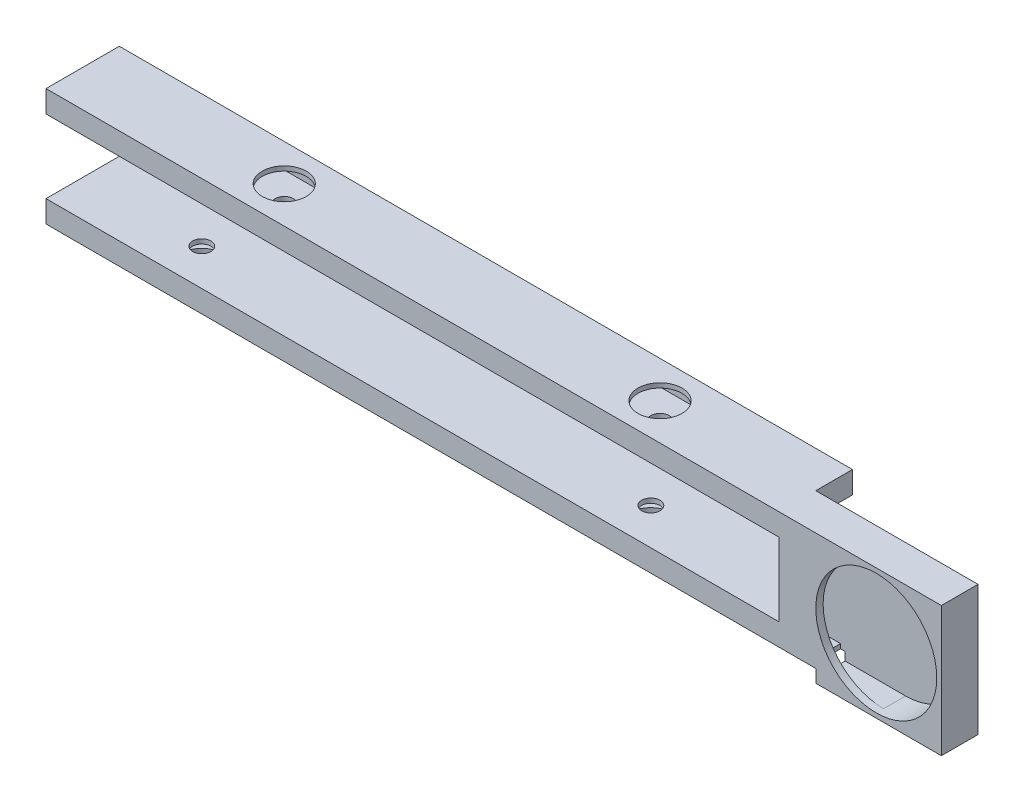
from build123d import *

# Parameters (mm, degrees)
BOSS_EXTRUDE11_DEPTH = 10
BOSS_EXTRUDE12_DEPTH = 2
BOSS_EXTRUDE15_START = -8
BOSS_EXTRUDE15_DEPTH = 2
BOSS_EXTRUDE19_START = -10
SKETCH1_20_W         = 1.25
SKETCH1_20_H         = 3.5
BOSS_EXTRUDE19_DEPTH = 10
BOSS_EXTRUDE20_START = -20
SKETCH1_21_W         = 197.5
SKETCH1_21_H         = 3.5
BOSS_EXTRUDE20_DEPTH = 2
CUT_EXTRUDE1_REACH   = 249.148
SKETCH2_R            = 2.5
SKETCH2_3_R          = 6
SKETCH2_3_R_2        = 2.5
CUT_EXTRUDE2_DEPTH   = 4.75
CUT_EXTRUDE3_REACH   = 249.625
SKETCH3_R            = 2.5
SKETCH3_3_R          = 6
SKETCH3_3_R_2        = 2.5
CUT_EXTRUDE4_DEPTH   = 4.75


with BuildPart() as part:
    # Sketch1 → Boss-Extrude11 (new body)
    with BuildSketch(Plane.XY):
        with BuildLine():
            Line((201.25, 4.75), (201.25, 27.25))
            Line((201.25, 27.25), (1.25, 27.25))
            Line((1.25, 27.25), (1.25, 30.75))
            Line((1.25, 30.75), (226.5, 30.75))
            ThreePointArc((226.5, 30.75), (243, 14.25), (226.5, -2.25))
            Line((226.5, -2.25), (210, -2.25))
            Line((210, -2.25), (210, -3.5))
            Line((210, -3.5), (244.25, -3.5))
            Line((244.25, -3.5), (244.25, 32))
            Line((244.25, 32), (0, 32))
            Line((0, 32), (0, 26))
            Line((0, 26), (200, 26))
            Line((200, 26), (200, 6))
            Line((200, 6), (0, 6))
            Line((0, 6), (0, 0))
            Line((0, 0), (208.75, 0))
            Line((208.75, 0), (208.75, 1.25))
            Line((208.75, 1.25), (1.25, 1.25))
            Line((1.25, 1.25), (1.25, 4.75))
            Line((1.25, 4.75), (201.25, 4.75))
        make_face()
    extrude(amount=-BOSS_EXTRUDE11_DEPTH)

    # Sketch1<12> → Boss-Extrude12 (add)
    with BuildSketch(Plane.XY):
        with BuildLine():
            Line((201.25, 4.75), (1.25, 4.75))
            Line((1.25, 4.75), (1.25, 1.25))
            Line((1.25, 1.25), (208.75, 1.25))
            Line((208.75, 1.25), (208.75, 0))
            Line((208.75, 0), (210, 0))
            Line((210, 0), (210, -2.25))
            Line((210, -2.25), (226.5, -2.25))
            ThreePointArc((226.5, -2.25), (210, 14.25), (226.5, 30.75))
            Line((226.5, 30.75), (1.25, 30.75))
            Line((1.25, 30.75), (1.25, 27.25))
            Line((1.25, 27.25), (201.25, 27.25))
            Line((201.25, 27.25), (201.25, 4.75))
        make_face()
    extrude(amount=-BOSS_EXTRUDE12_DEPTH)

    # Sketch1<14> → Boss-Extrude15 (add)
    with BuildSketch(Plane.XY.offset(BOSS_EXTRUDE15_START)):
        with BuildLine():
            Line((201.25, 4.75), (198.75, 4.75))
            Line((198.75, 4.75), (198.75, 1.25))
            Line((198.75, 1.25), (208.75, 1.25))
            Line((208.75, 1.25), (208.75, 0))
            Line((208.75, 0), (210, 0))
            Line((210, 0), (210, -2.25))
            Line((210, -2.25), (226.5, -2.25))
            ThreePointArc((226.5, -2.25), (243, 14.25), (226.5, 30.75))
            Line((226.5, 30.75), (198.75, 30.75))
            Line((198.75, 30.75), (198.75, 27.25))
            Line((198.75, 27.25), (201.25, 27.25))
            Line((201.25, 27.25), (201.25, 4.75))
        make_face()
    extrude(amount=-BOSS_EXTRUDE15_DEPTH)

    # Sketch1<20> → Boss-Extrude19 (add)
    with BuildSketch(Plane.XY.offset(BOSS_EXTRUDE19_START)):
        Polygon((0, 26), (200, 26), (200, 27.25), (198.75, 27.25), (1.25, 27.25), (1.25, 30.75), (198.75, 30.75), (200, 30.75), (200, 32), (0, 32), align=None)
        with Locations((199.375, 29)):
            Rectangle(SKETCH1_20_W, SKETCH1_20_H)
        with Locations((199.375, 3)):
            Rectangle(SKETCH1_20_W, SKETCH1_20_H)
        Polygon((200, 4.75), (200, 6), (0, 6), (0, 0), (200, 0), (200, 1.25), (198.75, 1.25), (1.25, 1.25), (1.25, 4.75), (198.75, 4.75), align=None)
    extrude(amount=-BOSS_EXTRUDE19_DEPTH)

    # Sketch1<21> → Boss-Extrude20 (add)
    with BuildSketch(Plane.XY.offset(BOSS_EXTRUDE20_START)):
        with Locations((100, 3)):
            Rectangle(SKETCH1_21_W, SKETCH1_21_H)
        with Locations((100, 29)):
            Rectangle(SKETCH1_21_W, SKETCH1_21_H)
    extrude(amount=BOSS_EXTRUDE20_DEPTH)

    # Cut-Extrude1: up to this face of the body (flat: up to its plane)
    cut_extrude1_end = Plane(part.part.faces().sort_by_distance((100, 6, -10))[0])
    # Sketch2 → Cut-Extrude1 (cut, up to the picked face)
    with BuildSketch(Plane.XZ, mode=Mode.PRIVATE) as cut_extrude1_sk1:
        with Locations((32.5, -10)):
            Circle(SKETCH2_R)
    cut_extrude1_tool1 = split(extrude(cut_extrude1_sk1.sketch, amount=-CUT_EXTRUDE1_REACH, mode=Mode.PRIVATE), bisect_by=cut_extrude1_end, keep=Keep.BOTH, mode=Mode.PRIVATE)
    # Sketch2 → Cut-Extrude1 (cut, up to the picked face)
    with BuildSketch(Plane.XZ, mode=Mode.PRIVATE) as cut_extrude1_sk2:
        with Locations((155, -10)):
            Circle(SKETCH2_R)
    cut_extrude1_tool2 = split(extrude(cut_extrude1_sk2.sketch, amount=-CUT_EXTRUDE1_REACH, mode=Mode.PRIVATE), bisect_by=cut_extrude1_end, keep=Keep.BOTH, mode=Mode.PRIVATE)
    add(cut_extrude1_tool1.solids().sort_by(Axis((32.5, 0, -10), (0, 1, 0)))[0], mode=Mode.SUBTRACT)
    add(cut_extrude1_tool2.solids().sort_by(Axis((155, 0, -10), (0, 1, 0)))[0], mode=Mode.SUBTRACT)

    # Sketch2<3> → Cut-Extrude2 (cut)
    # profile 1 of 2: a face of its own
    with BuildSketch(Plane.XZ):
        with Locations(Location((155, -10, 0), (0, 0, 270))):
            Circle(SKETCH2_3_R)
        with Locations((155, -10)):
            Circle(SKETCH2_3_R_2, mode=Mode.SUBTRACT)
    # profile 2 of 2: a face of its own
    with BuildSketch(Plane.XZ):
        with Locations(Location((32.5, -10, 0), (0, 0, 270))):
            Circle(SKETCH2_3_R)
        with Locations((32.5, -10)):
            Circle(SKETCH2_3_R_2, mode=Mode.SUBTRACT)
    extrude(amount=-CUT_EXTRUDE2_DEPTH, mode=Mode.SUBTRACT)

    # Cut-Extrude3: up to this face of the body (flat: up to its plane)
    cut_extrude3_end = Plane(part.part.faces().sort_by_distance((100, 26, -10))[0])
    # Sketch3 → Cut-Extrude3 (cut, up to the picked face)
    with BuildSketch(Plane(origin=(0, 32, 0), x_dir=(1, 0, 0), z_dir=(0, 1, 0)), mode=Mode.PRIVATE) as cut_extrude3_sk1:
        with Locations(Location((157.5, 10, 0), (0, 0, 180))):
            Circle(SKETCH3_R)
    cut_extrude3_tool1 = split(extrude(cut_extrude3_sk1.sketch, amount=-CUT_EXTRUDE3_REACH, mode=Mode.PRIVATE), bisect_by=cut_extrude3_end, keep=Keep.BOTH, mode=Mode.PRIVATE)
    # Sketch3 → Cut-Extrude3 (cut, up to the picked face)
    with BuildSketch(Plane(origin=(0, 32, 0), x_dir=(1, 0, 0), z_dir=(0, 1, 0)), mode=Mode.PRIVATE) as cut_extrude3_sk2:
        with Locations(Location((55, 10, 0), (0, 0, 180))):
            Circle(SKETCH3_R)
    cut_extrude3_tool2 = split(extrude(cut_extrude3_sk2.sketch, amount=-CUT_EXTRUDE3_REACH, mode=Mode.PRIVATE), bisect_by=cut_extrude3_end, keep=Keep.BOTH, mode=Mode.PRIVATE)
    add(cut_extrude3_tool1.solids().sort_by(Axis((157.5, 32, -10), (0, -1, 0)))[0], mode=Mode.SUBTRACT)
    add(cut_extrude3_tool2.solids().sort_by(Axis((55, 32, -10), (0, -1, 0)))[0], mode=Mode.SUBTRACT)

    # Sketch3<3> → Cut-Extrude4 (cut)
    # profile 1 of 2: a face of its own
    with BuildSketch(Plane(origin=(0, 32, 0), x_dir=(1, 0, 0), z_dir=(0, 1, 0))):
        with Locations(Location((157.5, 10, 0), (0, 0, 180))):
            Circle(SKETCH3_3_R)
        with Locations(Location((157.5, 10, 0), (0, 0, 180))):
            Circle(SKETCH3_3_R_2, mode=Mode.SUBTRACT)
    # profile 2 of 2: a face of its own
    with BuildSketch(Plane(origin=(0, 32, 0), x_dir=(1, 0, 0), z_dir=(0, 1, 0))):
        with Locations(Location((55, 10, 0), (0, 0, 180))):
            Circle(SKETCH3_3_R)
        with Locations(Location((55, 10, 0), (0, 0, 180))):
            Circle(SKETCH3_3_R_2, mode=Mode.SUBTRACT)
    extrude(amount=-CUT_EXTRUDE4_DEPTH, mode=Mode.SUBTRACT)


solid = part.part
